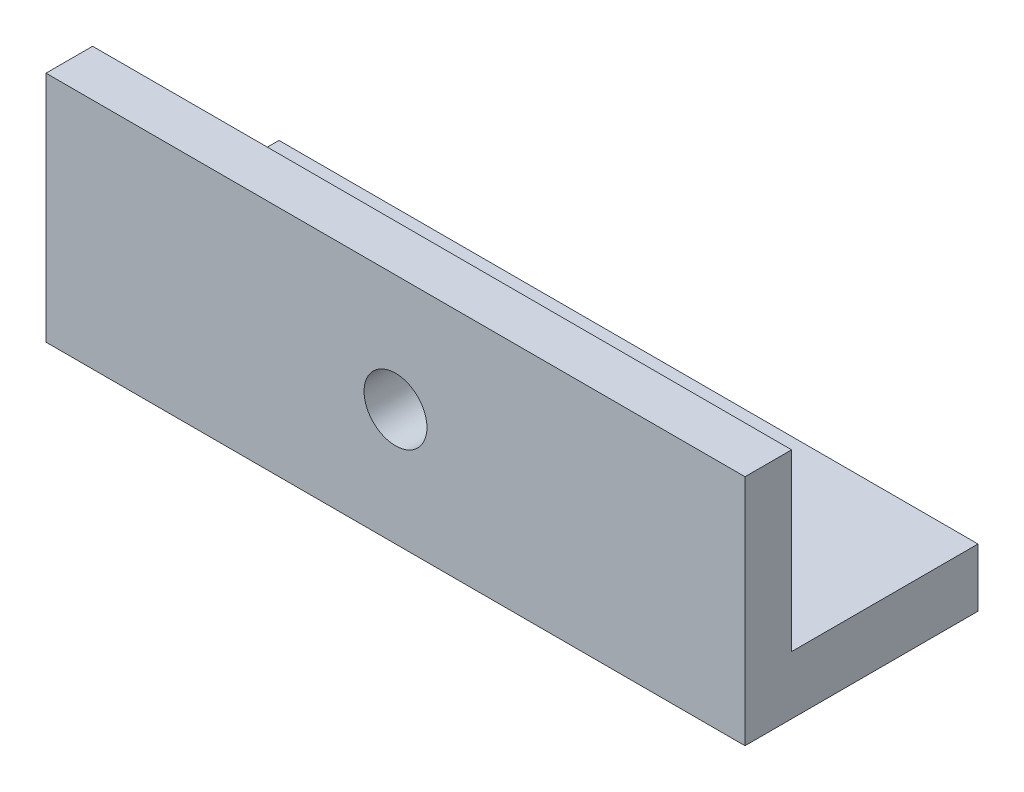
from build123d import *

# Parameters (mm, degrees)
SKETCH1_W           = 76.2
SKETCH1_H           = 25.4
SKETCH1_R           = 2.794
BOSS_EXTRUDE1_DEPTH = 6.35
SKETCH2_W           = 76.2
SKETCH2_H           = 5.08
BOSS_EXTRUDE2_DEPTH = 19.05
SKETCH3_R           = 3.429
CUT_EXTRUDE1_DEPTH  = 5.08


with BuildPart() as part:
    # Sketch1 → Boss-Extrude1 (new body)
    with BuildSketch(Plane(origin=(0, 0, 0), x_dir=(1, 0, 0), z_dir=(0, 1, 0))):
        with Locations((38.1, 12.7)):
            Rectangle(SKETCH1_W, SKETCH1_H)
        with Locations(Location((63.5, 12.7, 0), (0, 0, 270))):
            Circle(SKETCH1_R, mode=Mode.SUBTRACT)
        with Locations(Location((12.7, 12.7, 0), (0, 0, 270))):
            Circle(SKETCH1_R, mode=Mode.SUBTRACT)
    extrude(amount=BOSS_EXTRUDE1_DEPTH)

    # Sketch2 → Boss-Extrude2 (add)
    with BuildSketch(Plane(origin=(0, 6.35, 0), x_dir=(1, 0, 0), z_dir=(0, 1, 0))):
        with Locations((38.1, 2.54)):
            Rectangle(SKETCH2_W, SKETCH2_H)
    extrude(amount=BOSS_EXTRUDE2_DEPTH)

    # Sketch3 → Cut-Extrude1 (cut)
    with BuildSketch(Plane.XY):
        with Locations((38.1, 12.7)):
            Circle(SKETCH3_R)
    extrude(amount=-CUT_EXTRUDE1_DEPTH, mode=Mode.SUBTRACT)


solid = part.part
